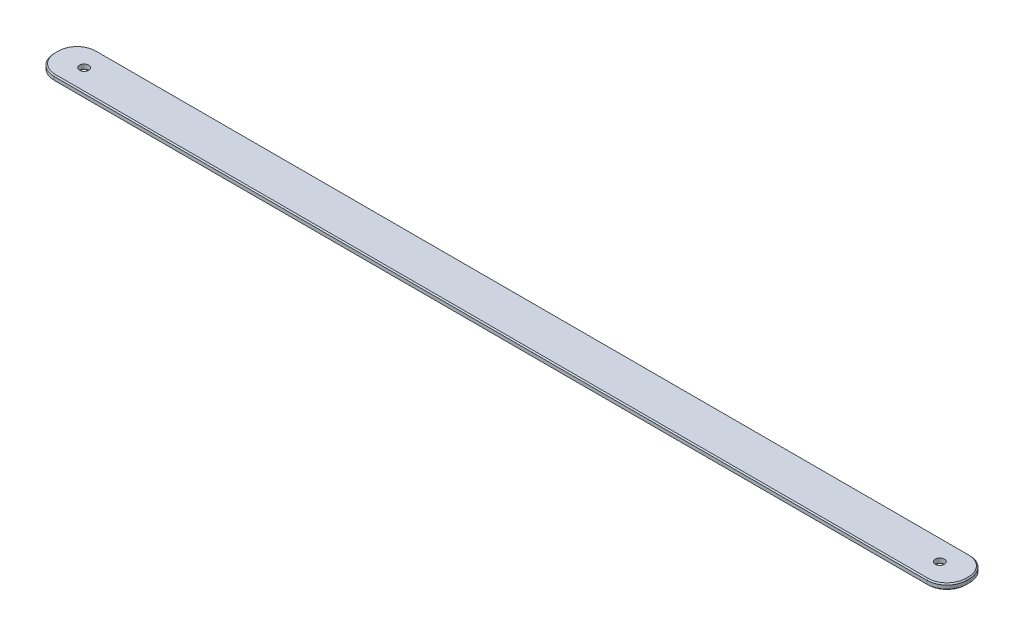
from build123d import *

# Parameters (mm, degrees)
SKETCH_1_W          = 320
SKETCH_1_H          = 15
EXTRUDE_1_DEPTH     = 2
SKETCH_2_R          = 1.6
CUT_EXTRUDE_1_DEPTH = 2
FILLET_1_R          = 7
CHAMFER_1_SIZE      = 0.4


with BuildPart() as part:
    # 草图1 → 凸台-拉伸1 (new body)
    with BuildSketch(Plane(origin=(0, 0, 0), x_dir=(1, 0, 0), z_dir=(0, 1, 0))):
        with Locations((160, 7.5)):
            Rectangle(SKETCH_1_W, SKETCH_1_H)
    extrude(amount=EXTRUDE_1_DEPTH)

    # 草图2 → 切除-拉伸1 (cut)
    with BuildSketch(Plane(origin=(0, 2, 0), x_dir=(1, 0, 0), z_dir=(0, 1, 0))):
        with Locations(Location((10, 7.5, 0), (0, 0, 270))):
            Circle(SKETCH_2_R)
        with Locations(Location((310, 7.5, 0), (0, 0, 270))):
            Circle(SKETCH_2_R)
    extrude(amount=-CUT_EXTRUDE_1_DEPTH, mode=Mode.SUBTRACT)

    # 圆角1
    fillet_1_edges = [part.edges().sort_by_distance(p)[0] for p in [
        (0, 1, -15),
        (320, 1, -15),
        (320, 1, 0),
        (0, 1, 0),
    ]]
    fillet(fillet_1_edges, radius=FILLET_1_R)

    # 倒角1
    chamfer_1_edges = [part.edges().sort_by_distance(p)[0] for p in [
        (10, 0, -9.1),
        (310, 0, -9.1),
        (160, 0, -15),
        (160, 2, -15),
        (0, 0, -7.5),
        (320, 0, -7.5),
        (160, 0, 0),
        (2.050252532, 0, -12.949747468),
        (2.050252532, 0, -2.050252532),
        (317.949747468, 0, -2.050252532),
        (317.949747468, 0, -12.949747468),
        (320, 2, -7.5),
        (0, 2, -7.5),
        (160, 2, 0),
        (2.050252532, 2, -12.949747468),
        (2.050252532, 2, -2.050252532),
        (317.949747468, 2, -2.050252532),
        (317.949747468, 2, -12.949747468),
    ]]
    chamfer(chamfer_1_edges, length=CHAMFER_1_SIZE)


solid = part.part
